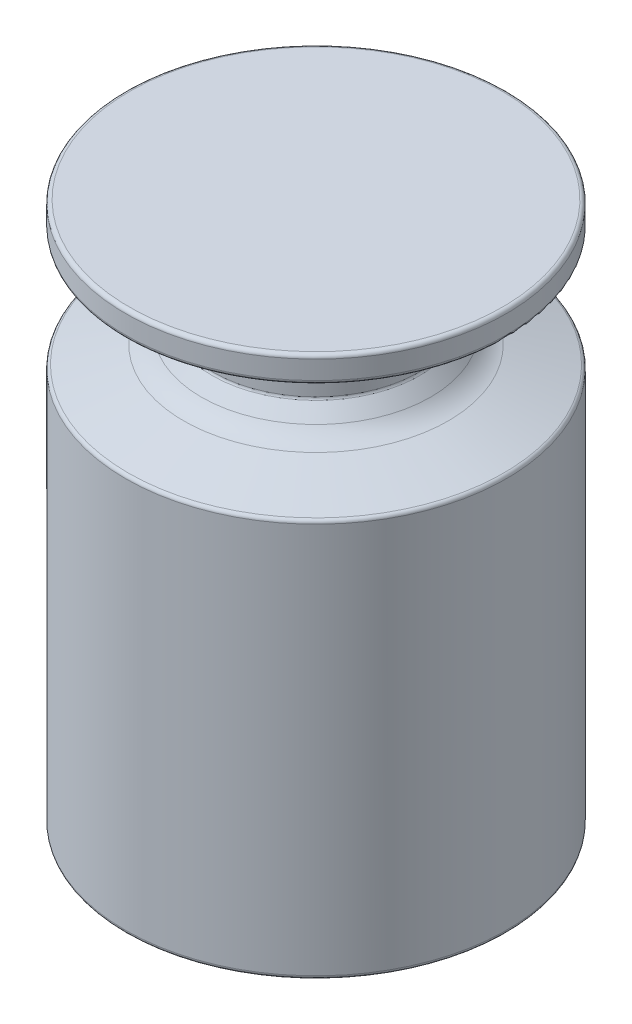
from build123d import *

# Parameters (mm, degrees)
FILLET1_R = 5
FILLET2_R = 0.5


with BuildPart() as part:
    # Sketch1 → Revolve1 (revolve)
    with BuildSketch(Plane.XY, mode=Mode.PRIVATE) as revolve1_sk:
        Polygon((25, 32.25), (16, 29.4123109), (13.5, 26.45), (13.5, 22.45), (16, 19.4876891), (25, 16.65), (25, -35.55), (0, -35.55), (0, 35.55), (25, 35.55), align=None)
    revolve(revolve1_sk.sketch.rotate(Axis((0, 67.092271098, 0), (0, -1, 0)), 90), axis=Axis((0, 67.092271098, 0), (0, -1, 0)))

    # Fillet1
    fillet1_edges = [part.edges().sort_by_distance(p)[0] for p in [
        (0, 19.4876891, -16),
        (0, 29.4123109, -16),
    ]]
    fillet(fillet1_edges, radius=FILLET1_R)

    # Fillet2
    fillet2_edges = [part.edges().sort_by_distance(p)[0] for p in [
        (0, 16.65, -25),
        (0, -35.55, -25),
        (0, 35.55, -25),
        (0, 32.25, -25),
        (0, 26.45, -13.5),
        (0, 22.45, -13.5),
    ]]
    fillet(fillet2_edges, radius=FILLET2_R)


solid = part.part
